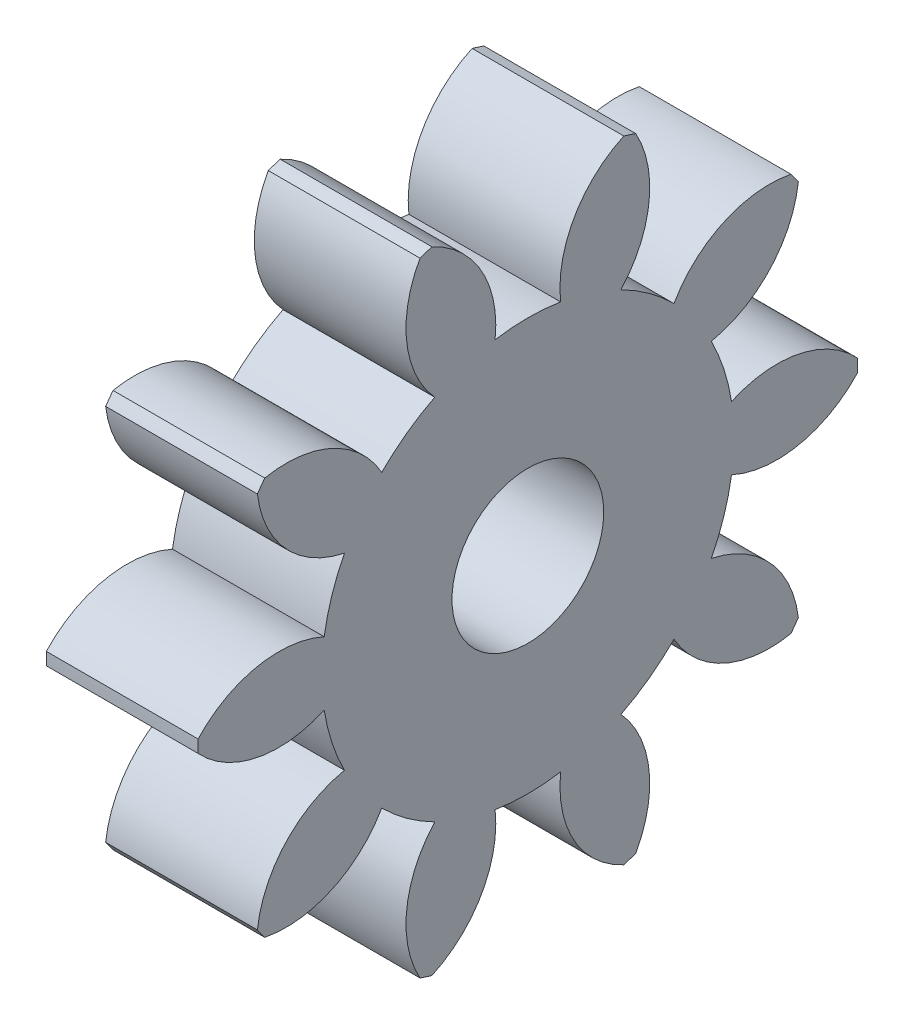
from build123d import *

# Parameters (mm, degrees)
BASPROSKE_W         = 5.842
BASPROSKE_H         = 12.7
TOOTHCUT_DEPTH      = 19.886740428
TEETHCUTS_COUNT     = 10
TEETHCUTS_ANGLE     = 324
BORSKE_R            = 3.175
BORE_DEPTH          = 50.8000508
SKETCH1_R           = 3.175
SKETCH1_R_2         = 2.921
BOSS_EXTRUDE1_DEPTH = 5.842


with BuildPart() as part:
    # BasProSke → Base-Revolve (revolve)
    with BuildSketch(Plane(origin=(0, 0, 0), x_dir=(1, 0, 0), z_dir=(0, 1, 0)), mode=Mode.PRIVATE) as base_revolve_sk:
        with Locations((2.921, 6.35)):
            Rectangle(BASPROSKE_W, BASPROSKE_H)
    revolve(base_revolve_sk.sketch.rotate(Axis((-10, 0, 0), (1, 0, 0)), 180), axis=Axis((-10, 0, 0), (1, 0, 0)))

    # TooCutSke → ToothCut (cut, through all)
    with BuildSketch(Plane(origin=(0, 0, 0), x_dir=(0, 0, -1), z_dir=(1, 0, 0))):
        with BuildLine():
            ThreePointArc((1.261053733, 7.835399804), (0, 7.93623), (-1.261053733, 7.835399804))
            ThreePointArc((-1.261053733, 7.835399804), (-1.789991322, 10.402889218), (-3.729263267, 12.166692264))
            ThreePointArc((-3.729263267, 12.166692264), (0, 12.7254), (3.729263267, 12.166692264))
            ThreePointArc((3.729263267, 12.166692264), (1.789991322, 10.402889218), (1.261053733, 7.835399804))
        make_face()
    toothcut = extrude(amount=TOOTHCUT_DEPTH, mode=Mode.SUBTRACT)

    # TeethCuts: ToothCut ×10 about axis
    teethcuts_axis = Axis((-10, 0, 0), (1, 0, 0))
    for i in range(1, TEETHCUTS_COUNT):
        add(toothcut.rotate(teethcuts_axis, i * TEETHCUTS_ANGLE / (TEETHCUTS_COUNT - 1)), mode=Mode.SUBTRACT)

    # BorSke → Bore (cut, symmetric)
    with BuildSketch(Plane(origin=(0, 0, 0), x_dir=(0, 0, -1), z_dir=(1, 0, 0))):
        with Locations(Location((0, 0, 0), (0, 0, 180))):
            Circle(BORSKE_R)
    extrude(amount=BORE_DEPTH, both=True, mode=Mode.SUBTRACT)

    # Sketch1 → Boss-Extrude1 (add)
    with BuildSketch(Plane(origin=(5.842, 0, 0), x_dir=(0, 0, -1), z_dir=(1, 0, 0))):
        Circle(SKETCH1_R)
        Circle(SKETCH1_R_2, mode=Mode.SUBTRACT)
    extrude(amount=-BOSS_EXTRUDE1_DEPTH)


solid = part.part
